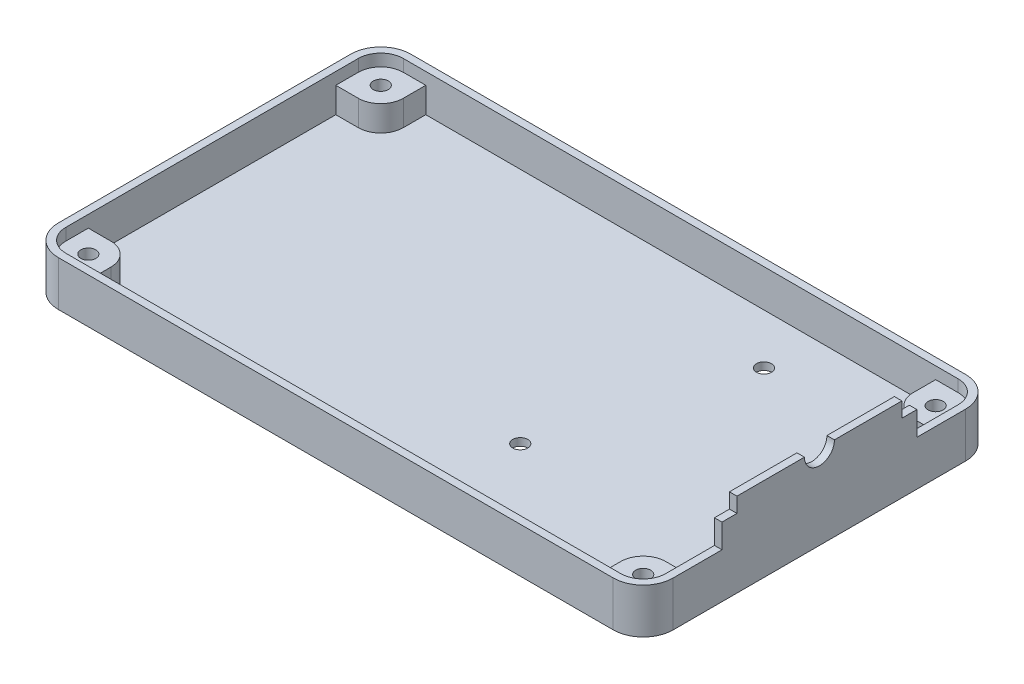
from build123d import *

# Parameters (mm, degrees)
EXTRUDE_1_DEPTH          = 1
EXTRUDE_START            = 5
EXTRUDE_2_DEPTH          = 5
CUT_EXTRUDE_2_DEPTH      = 5
EXTRUDE_3_DEPTH          = 3.4
CUT_EXTRUDE_3_DEPTH      = 94.28451104
CUT_EXTRUDE_3_DEPTH_BACK = 94.28451104
SKETCH_4_R               = 1
SKETCH_7_R               = 1
CUT_EXTRUDE_8_DEPTH      = 94.28451104
SKETCH_8_R               = 2.6
CUT_EXTRUDE_9_DEPTH      = 2
SKETCH_9_W               = 1
SKETCH_9_H               = 26
EXTRUDE_4_DEPTH          = 5.2
CUT_EXTRUDE_11_REACH     = 96.573
SKETCH_10_R              = 2
SKETCH_10_W              = 2
SKETCH_10_H              = 4


with BuildPart() as part:
    # 草图1 → 凸台-拉伸1 (new body)
    with BuildSketch(Plane(origin=(0, 0, 0), x_dir=(1, 0, 0), z_dir=(0, 1, 0))):
        with BuildLine():
            Line((3, -1), (77, -1))
            ThreePointArc((77, -1), (79.828427125, 0.171572875), (81, 3))
            Line((81, 3), (81, 42))
            ThreePointArc((81, 42), (79.828427125, 44.828427125), (77, 46))
            Line((77, 46), (3, 46))
            ThreePointArc((3, 46), (0.171572875, 44.828427125), (-1, 42))
            Line((-1, 42), (-1, 3))
            ThreePointArc((-1, 3), (0.171572875, 0.171572875), (3, -1))
        make_face()
    extrude(amount=-EXTRUDE_1_DEPTH)

    # 草图1<3> → 凸台-拉伸2 (add)
    with BuildSketch(Plane(origin=(0, 0, 0), x_dir=(1, 0, 0), z_dir=(0, 1, 0)).offset(EXTRUDE_START)):
        with BuildLine():
            Line((3, -1), (77, -1))
            ThreePointArc((77, -1), (79.828427125, 0.171572875), (81, 3))
            Line((81, 3), (81, 42))
            ThreePointArc((81, 42), (79.828427125, 44.828427125), (77, 46))
            Line((77, 46), (3, 46))
            ThreePointArc((3, 46), (0.171572875, 44.828427125), (-1, 42))
            Line((-1, 42), (-1, 3))
            ThreePointArc((-1, 3), (0.171572875, 0.171572875), (3, -1))
        make_face()
    extrude(amount=-EXTRUDE_2_DEPTH)

    # 草图6 → 切除-拉伸2 (cut)
    with BuildSketch(Plane(origin=(0, 0, 0), x_dir=(1, 0, 0), z_dir=(0, 1, 0))):
        with BuildLine():
            Line((80, 3), (80, 42))
            ThreePointArc((80, 42), (79.121320344, 44.121320344), (77, 45))
            Line((77, 45), (3, 45))
            ThreePointArc((3, 45), (0.878679656, 44.121320344), (0, 42))
            Line((0, 42), (0, 3))
            ThreePointArc((0, 3), (0.878679656, 0.878679656), (3, 0))
            Line((3, 0), (77, 0))
            ThreePointArc((77, 0), (79.121320344, 0.878679656), (80, 3))
        make_face()
    extrude(amount=CUT_EXTRUDE_2_DEPTH, mode=Mode.SUBTRACT)

    # 草图5 → 凸台-拉伸3 (add)
    with BuildSketch(Plane(origin=(0, 0, 0), x_dir=(1, 0, 0), z_dir=(0, 1, 0))):
        with BuildLine():
            Line((77, 6), (80, 6))
            Line((80, 6), (80, 3))
            ThreePointArc((80, 3), (79.121320344, 0.878679656), (77, 0))
            Line((77, 0), (74, 0))
            Line((74, 0), (74, 3))
            ThreePointArc((74, 3), (74.878679656, 5.121320344), (77, 6))
        make_face()
        with BuildLine():
            Line((77, 45), (74, 45))
            Line((74, 45), (74, 42))
            ThreePointArc((74, 42), (74.878679656, 39.878679656), (77, 39))
            Line((77, 39), (80, 39))
            Line((80, 39), (80, 42))
            ThreePointArc((80, 42), (79.121320344, 44.121320344), (77, 45))
        make_face()
        with BuildLine():
            Line((0, 42), (0, 39))
            Line((0, 39), (3, 39))
            ThreePointArc((3, 39), (5.121320344, 39.878679656), (6, 42))
            Line((6, 42), (6, 45))
            Line((6, 45), (3, 45))
            ThreePointArc((3, 45), (0.878679656, 44.121320344), (0, 42))
        make_face()
        with BuildLine():
            Line((3, 6), (0, 6))
            Line((0, 6), (0, 3))
            ThreePointArc((0, 3), (0.878679656, 0.878679656), (3, 0))
            Line((3, 0), (6, 0))
            Line((6, 0), (6, 3))
            ThreePointArc((6, 3), (5.121320344, 5.121320344), (3, 6))
        make_face()
    extrude(amount=EXTRUDE_3_DEPTH)

    # 草图4 → 切除-拉伸3 (cut, two sides: drawn at the far end of the back side and taken through both)
    with BuildSketch(Plane(origin=(0, 0, 0), x_dir=(1, 0, 0), z_dir=(0, 1, 0)).offset(-CUT_EXTRUDE_3_DEPTH_BACK)):
        with Locations((3, 42)):
            Circle(SKETCH_4_R)
        with Locations((3, 3)):
            Circle(SKETCH_4_R)
        with Locations((77, 3)):
            Circle(SKETCH_4_R)
        with Locations((77, 42)):
            Circle(SKETCH_4_R)
    extrude(amount=CUT_EXTRUDE_3_DEPTH + CUT_EXTRUDE_3_DEPTH_BACK, mode=Mode.SUBTRACT)

    # 草图7 → 切除-拉伸8 (cut, through all)
    with BuildSketch(Plane(origin=(0, 0, 0), x_dir=(1, 0, 0), z_dir=(0, 1, 0))):
        with Locations((50.3, 13.3)):
            Circle(SKETCH_7_R)
        with Locations((57.8, 38.3)):
            Circle(SKETCH_7_R)
    extrude(amount=-CUT_EXTRUDE_8_DEPTH, mode=Mode.SUBTRACT)

    # 草图8 → 切除-拉伸9 (cut)
    with BuildSketch(Plane.XZ.offset(1)):
        with Locations((3, -3)):
            Circle(SKETCH_8_R)
        with Locations((77, -3)):
            Circle(SKETCH_8_R)
        with Locations((3, -42)):
            Circle(SKETCH_8_R)
        with Locations((77, -42)):
            Circle(SKETCH_8_R)
    extrude(amount=-CUT_EXTRUDE_9_DEPTH, mode=Mode.SUBTRACT)

    # 草图9 → 凸台-拉伸4 (add)
    with BuildSketch(Plane(origin=(0, 5, 0), x_dir=(1, 0, 0), z_dir=(0, 1, 0))):
        with Locations((80.5, 22.5)):
            Rectangle(SKETCH_9_W, SKETCH_9_H)
    extrude(amount=EXTRUDE_4_DEPTH)

    # 草图10 → 切除-拉伸11 (cut, up to next)
    with BuildSketch(Plane(origin=(81, 0, 0), x_dir=(0, 0, -1), z_dir=(1, 0, 0)), mode=Mode.PRIVATE) as cut_extrude_11_sk1:
        with Locations((22.5, 10.2)):
            Circle(SKETCH_10_R)
    cut_extrude_11_tool1 = extrude(cut_extrude_11_sk1.sketch, amount=-CUT_EXTRUDE_11_REACH, mode=Mode.PRIVATE) & part.part
    # 草图10 → 切除-拉伸11 (cut, up to next)
    with BuildSketch(Plane(origin=(81, 0, 0), x_dir=(0, 0, -1), z_dir=(1, 0, 0)), mode=Mode.PRIVATE) as cut_extrude_11_sk2:
        with Locations((10.5, 10.2)):
            Rectangle(SKETCH_10_W, SKETCH_10_H)
    cut_extrude_11_tool2 = extrude(cut_extrude_11_sk2.sketch, amount=-CUT_EXTRUDE_11_REACH, mode=Mode.PRIVATE) & part.part
    # 草图10 → 切除-拉伸11 (cut, up to next)
    with BuildSketch(Plane(origin=(81, 0, 0), x_dir=(0, 0, -1), z_dir=(1, 0, 0)), mode=Mode.PRIVATE) as cut_extrude_11_sk3:
        with Locations((34.5, 10.2)):
            Rectangle(SKETCH_10_W, SKETCH_10_H)
    cut_extrude_11_tool3 = extrude(cut_extrude_11_sk3.sketch, amount=-CUT_EXTRUDE_11_REACH, mode=Mode.PRIVATE) & part.part
    add(cut_extrude_11_tool1.solids().sort_by_distance((81, 10.2, -22.5))[0], mode=Mode.SUBTRACT)
    add(cut_extrude_11_tool2.solids().sort_by_distance((81, 10.2, -10.5))[0], mode=Mode.SUBTRACT)
    add(cut_extrude_11_tool3.solids().sort_by_distance((81, 10.2, -34.5))[0], mode=Mode.SUBTRACT)


solid = part.part
